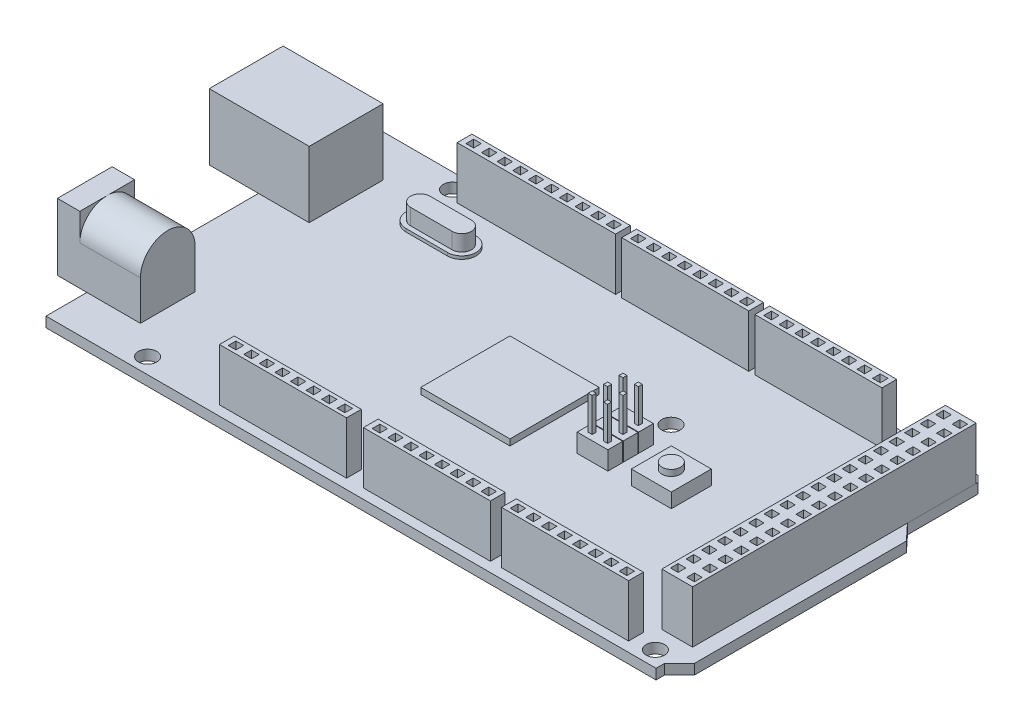
from build123d import *

# Parameters (mm, degrees)
SKETCH3_R            = 1.5
BOSS_EXTRUDE1_DEPTH  = 1.65
SKETCH4_W            = 16.25
SKETCH4_H            = 12
BOSS_EXTRUDE2_DEPTH  = 10.75
SKETCH5_W            = 13.5
SKETCH5_H            = 8.9
BOSS_EXTRUDE3_DEPTH  = 10.85
CUT_EXTRUDE1_DEPTH   = 9.85
SKETCH7_W            = 5.7
SKETCH7_H            = 3.15
CUT_EXTRUDE2_DEPTH   = 13
SKETCH8_R            = 3
SKETCH8_R_2          = 0.75
CUT_EXTRUDE3_DEPTH   = 10
FILLET1_R            = 0.75
SKETCH9_W            = 5
SKETCH9_H            = 46.1
SKETCH9_W_2          = 1.25
SKETCH9_H_2          = 1.25
BOSS_EXTRUDE4_DEPTH  = 8.5
SKETCH10_W           = 25.75
SKETCH10_H           = 2.4
SKETCH10_W_2         = 1.25
SKETCH10_H_2         = 1.25
SKETCH10_W_3         = 20.65
BOSS_EXTRUDE6_DEPTH  = 8.5
SKETCH11_W           = 14.5
SKETCH11_H           = 14.5
BOSS_EXTRUDE7_DEPTH  = 1
BOSS_EXTRUDE8_DEPTH  = 0.5
BOSS_EXTRUDE9_DEPTH  = 2.6
SKETCH14_W           = 5
SKETCH14_H           = 2.4
BOSS_EXTRUDE10_DEPTH = 3
SKETCH15_W           = 0.65
SKETCH15_H           = 0.65
BOSS_EXTRUDE11_DEPTH = 5.5
SKETCH16_W           = 6.5
SKETCH16_H           = 6.5
BOSS_EXTRUDE12_DEPTH = 2.35
SKETCH17_R           = 1.5
BOSS_EXTRUDE13_DEPTH = 1


with BuildPart() as part:
    # Sketch3 → Boss-Extrude1 (new body)
    with BuildSketch(Plane(origin=(0, 0, 0), x_dir=(1, 0, 0), z_dir=(0, 1, 0))):
        Polygon((-50.8, -26.67), (48.367298703, -26.67), (48.367298703, -25.307134577), (50.8, -22.87443328), (50.8, 11.598588355), (48.367298703, 14.201289652), (48.367298703, 25.67), (47.367298703, 26.67), (-50.8, 26.67), align=None)
        with Locations(Location((-36.83, -24.13, 0), (0, 0, 270))):
            Circle(SKETCH3_R, mode=Mode.SUBTRACT)
        with Locations(Location((15.24, -19.05, 0), (0, 0, 270))):
            Circle(SKETCH3_R, mode=Mode.SUBTRACT)
        with Locations(Location((45.72, -24.13, 0), (0, 0, 270))):
            Circle(SKETCH3_R, mode=Mode.SUBTRACT)
        with Locations(Location((-35.56, 24.17, 0), (0, 0, 270))):
            Circle(SKETCH3_R, mode=Mode.SUBTRACT)
        with Locations(Location((15.3, 8.83, 0), (0, 0, 270))):
            Circle(SKETCH3_R, mode=Mode.SUBTRACT)
        with Locations(Location((39.37, 24.17, 0), (0, 0, 270))):
            Circle(SKETCH3_R, mode=Mode.SUBTRACT)
    extrude(amount=BOSS_EXTRUDE1_DEPTH)

    # Sketch10 → Boss-Extrude6 (add)
    # profile 1 of 6: a face of its own
    with BuildSketch(Plane(origin=(0, 1.65, 0), x_dir=(1, 0, 0), z_dir=(0, 1, 0))):
        with Locations((-20.425, 23.87)):
            Rectangle(SKETCH10_W, SKETCH10_H)
        with Locations((-11.558333333, 23.87)):
            Rectangle(SKETCH10_W_2, SKETCH10_H_2, mode=Mode.SUBTRACT)
        with Locations((-9.025, 23.87)):
            Rectangle(SKETCH10_W_2, SKETCH10_H_2, mode=Mode.SUBTRACT)
        with Locations((-14.091666667, 23.87)):
            Rectangle(SKETCH10_W_2, SKETCH10_H_2, mode=Mode.SUBTRACT)
        with Locations((-16.625, 23.87)):
            Rectangle(SKETCH10_W_2, SKETCH10_H_2, mode=Mode.SUBTRACT)
        with Locations((-19.158333333, 23.87)):
            Rectangle(SKETCH10_W_2, SKETCH10_H_2, mode=Mode.SUBTRACT)
        with Locations((-21.691666667, 23.87)):
            Rectangle(SKETCH10_W_2, SKETCH10_H_2, mode=Mode.SUBTRACT)
        with Locations((-24.225, 23.87)):
            Rectangle(SKETCH10_W_2, SKETCH10_H_2, mode=Mode.SUBTRACT)
        with Locations((-26.758333333, 23.87)):
            Rectangle(SKETCH10_W_2, SKETCH10_H_2, mode=Mode.SUBTRACT)
        with Locations((-29.291666667, 23.87)):
            Rectangle(SKETCH10_W_2, SKETCH10_H_2, mode=Mode.SUBTRACT)
        with Locations((-31.825, 23.87)):
            Rectangle(SKETCH10_W_2, SKETCH10_H_2, mode=Mode.SUBTRACT)
    # profile 2 of 6: a face of its own
    with BuildSketch(Plane(origin=(0, 1.65, 0), x_dir=(1, 0, 0), z_dir=(0, 1, 0))):
        with Locations((3.775, 23.87)):
            Rectangle(SKETCH10_W_3, SKETCH10_H)
        with Locations((10.096428571, 23.87)):
            Rectangle(SKETCH10_W_2, SKETCH10_H_2, mode=Mode.SUBTRACT)
        with Locations((12.625, 23.87)):
            Rectangle(SKETCH10_W_2, SKETCH10_H_2, mode=Mode.SUBTRACT)
        with Locations((7.567857143, 23.87)):
            Rectangle(SKETCH10_W_2, SKETCH10_H_2, mode=Mode.SUBTRACT)
        with Locations((5.039285714, 23.87)):
            Rectangle(SKETCH10_W_2, SKETCH10_H_2, mode=Mode.SUBTRACT)
        with Locations((2.510714286, 23.87)):
            Rectangle(SKETCH10_W_2, SKETCH10_H_2, mode=Mode.SUBTRACT)
        with Locations((-0.017857143, 23.87)):
            Rectangle(SKETCH10_W_2, SKETCH10_H_2, mode=Mode.SUBTRACT)
        with Locations((-2.546428571, 23.87)):
            Rectangle(SKETCH10_W_2, SKETCH10_H_2, mode=Mode.SUBTRACT)
        with Locations((-5.075, 23.87)):
            Rectangle(SKETCH10_W_2, SKETCH10_H_2, mode=Mode.SUBTRACT)
    # profile 3 of 6: a face of its own
    with BuildSketch(Plane(origin=(0, 1.65, 0), x_dir=(1, 0, 0), z_dir=(0, 1, 0))):
        with Locations((25.425, 23.87)):
            Rectangle(SKETCH10_W_3, SKETCH10_H)
        with Locations((31.746428571, 23.87)):
            Rectangle(SKETCH10_W_2, SKETCH10_H_2, mode=Mode.SUBTRACT)
        with Locations((34.275, 23.87)):
            Rectangle(SKETCH10_W_2, SKETCH10_H_2, mode=Mode.SUBTRACT)
        with Locations((29.217857143, 23.87)):
            Rectangle(SKETCH10_W_2, SKETCH10_H_2, mode=Mode.SUBTRACT)
        with Locations((26.689285714, 23.87)):
            Rectangle(SKETCH10_W_2, SKETCH10_H_2, mode=Mode.SUBTRACT)
        with Locations((24.160714286, 23.87)):
            Rectangle(SKETCH10_W_2, SKETCH10_H_2, mode=Mode.SUBTRACT)
        with Locations((21.632142857, 23.87)):
            Rectangle(SKETCH10_W_2, SKETCH10_H_2, mode=Mode.SUBTRACT)
        with Locations((19.103571429, 23.87)):
            Rectangle(SKETCH10_W_2, SKETCH10_H_2, mode=Mode.SUBTRACT)
        with Locations((16.575, 23.87)):
            Rectangle(SKETCH10_W_2, SKETCH10_H_2, mode=Mode.SUBTRACT)
    # profile 4 of 6: a face of its own
    with BuildSketch(Plane(origin=(0, 1.65, 0), x_dir=(1, 0, 0), z_dir=(0, 1, 0))):
        with Locations((31.975, -23.87)):
            Rectangle(SKETCH10_W_3, SKETCH10_H)
        with Locations((38.296428571, -23.87)):
            Rectangle(SKETCH10_W_2, SKETCH10_H_2, mode=Mode.SUBTRACT)
        with Locations((40.825, -23.87)):
            Rectangle(SKETCH10_W_2, SKETCH10_H_2, mode=Mode.SUBTRACT)
        with Locations((35.767857143, -23.87)):
            Rectangle(SKETCH10_W_2, SKETCH10_H_2, mode=Mode.SUBTRACT)
        with Locations((33.239285714, -23.87)):
            Rectangle(SKETCH10_W_2, SKETCH10_H_2, mode=Mode.SUBTRACT)
        with Locations((30.710714286, -23.87)):
            Rectangle(SKETCH10_W_2, SKETCH10_H_2, mode=Mode.SUBTRACT)
        with Locations((28.182142857, -23.87)):
            Rectangle(SKETCH10_W_2, SKETCH10_H_2, mode=Mode.SUBTRACT)
        with Locations((25.653571429, -23.87)):
            Rectangle(SKETCH10_W_2, SKETCH10_H_2, mode=Mode.SUBTRACT)
        with Locations((23.125, -23.87)):
            Rectangle(SKETCH10_W_2, SKETCH10_H_2, mode=Mode.SUBTRACT)
    # profile 5 of 6: a face of its own
    with BuildSketch(Plane(origin=(0, 1.65, 0), x_dir=(1, 0, 0), z_dir=(0, 1, 0))):
        with Locations((9.525, -23.87)):
            Rectangle(SKETCH10_W_3, SKETCH10_H)
        with Locations((18.375, -23.87)):
            Rectangle(SKETCH10_W_2, SKETCH10_H_2, mode=Mode.SUBTRACT)
        with Locations((15.846428571, -23.87)):
            Rectangle(SKETCH10_W_2, SKETCH10_H_2, mode=Mode.SUBTRACT)
        with Locations((13.317857143, -23.87)):
            Rectangle(SKETCH10_W_2, SKETCH10_H_2, mode=Mode.SUBTRACT)
        with Locations((10.789285714, -23.87)):
            Rectangle(SKETCH10_W_2, SKETCH10_H_2, mode=Mode.SUBTRACT)
        with Locations((8.260714286, -23.87)):
            Rectangle(SKETCH10_W_2, SKETCH10_H_2, mode=Mode.SUBTRACT)
        with Locations((5.732142857, -23.87)):
            Rectangle(SKETCH10_W_2, SKETCH10_H_2, mode=Mode.SUBTRACT)
        with Locations((3.203571429, -23.87)):
            Rectangle(SKETCH10_W_2, SKETCH10_H_2, mode=Mode.SUBTRACT)
        with Locations((0.675, -23.87)):
            Rectangle(SKETCH10_W_2, SKETCH10_H_2, mode=Mode.SUBTRACT)
    # profile 6 of 6: a face of its own
    with BuildSketch(Plane(origin=(0, 1.65, 0), x_dir=(1, 0, 0), z_dir=(0, 1, 0))):
        with Locations((-13.875, -23.87)):
            Rectangle(SKETCH10_W_3, SKETCH10_H)
        with Locations((-7.553571429, -23.87)):
            Rectangle(SKETCH10_W_2, SKETCH10_H_2, mode=Mode.SUBTRACT)
        with Locations((-5.025, -23.87)):
            Rectangle(SKETCH10_W_2, SKETCH10_H_2, mode=Mode.SUBTRACT)
        with Locations((-10.082142857, -23.87)):
            Rectangle(SKETCH10_W_2, SKETCH10_H_2, mode=Mode.SUBTRACT)
        with Locations((-12.610714286, -23.87)):
            Rectangle(SKETCH10_W_2, SKETCH10_H_2, mode=Mode.SUBTRACT)
        with Locations((-15.139285714, -23.87)):
            Rectangle(SKETCH10_W_2, SKETCH10_H_2, mode=Mode.SUBTRACT)
        with Locations((-17.667857143, -23.87)):
            Rectangle(SKETCH10_W_2, SKETCH10_H_2, mode=Mode.SUBTRACT)
        with Locations((-20.196428571, -23.87)):
            Rectangle(SKETCH10_W_2, SKETCH10_H_2, mode=Mode.SUBTRACT)
        with Locations((-22.725, -23.87)):
            Rectangle(SKETCH10_W_2, SKETCH10_H_2, mode=Mode.SUBTRACT)
    extrude(amount=BOSS_EXTRUDE6_DEPTH)

    # Sketch11 → Boss-Extrude7 (add)
    with BuildSketch(Plane(origin=(0, 1.65, 0), x_dir=(1, 0, 0), z_dir=(0, 1, 0))):
        with Locations((-2.05, 0)):
            Rectangle(SKETCH11_W, SKETCH11_H)
    extrude(amount=BOSS_EXTRUDE7_DEPTH)

    # Sketch12 → Boss-Extrude8 (add)
    with BuildSketch(Plane(origin=(0, 1.65, 0), x_dir=(1, 0, 0), z_dir=(0, 1, 0))):
        with BuildLine():
            Line((-33.375, 19.07), (-26.625, 19.07))
            ThreePointArc((-26.625, 19.07), (-24.3, 16.745), (-26.625, 14.42))
            Line((-26.625, 14.42), (-33.375, 14.42))
            ThreePointArc((-33.375, 14.42), (-35.7, 16.745), (-33.375, 19.07))
        make_face()
    extrude(amount=BOSS_EXTRUDE8_DEPTH)

    # Sketch13 → Boss-Extrude9 (add)
    with BuildSketch(Plane(origin=(0, 2.15, 0), x_dir=(1, 0, 0), z_dir=(0, 1, 0))):
        with BuildLine():
            Line((-33.375, 18.32), (-26.625, 18.32))
            ThreePointArc((-26.625, 18.32), (-25.05, 16.745), (-26.625, 15.17))
            Line((-26.625, 15.17), (-33.375, 15.17))
            ThreePointArc((-33.375, 15.17), (-34.95, 16.745), (-33.375, 18.32))
        make_face()
    extrude(amount=BOSS_EXTRUDE9_DEPTH)

    # Sketch14 → Boss-Extrude10 (add)
    with BuildSketch(Plane(origin=(0, 1.65, 0), x_dir=(1, 0, 0), z_dir=(0, 1, 0))):
        with Locations((14.2, 0.87)):
            Rectangle(SKETCH14_W, SKETCH14_H)
        with Locations((14.2, -1.63)):
            Rectangle(SKETCH14_W, SKETCH14_H)
        with Locations((14.2, 3.37)):
            Rectangle(SKETCH14_W, SKETCH14_H)
    extrude(amount=BOSS_EXTRUDE10_DEPTH)

    # Sketch15 → Boss-Extrude11 (add)
    with BuildSketch(Plane(origin=(0, 4.65, 0), x_dir=(1, 0, 0), z_dir=(0, 1, 0))):
        with Locations((15.45, -1.63)):
            Rectangle(SKETCH15_W, SKETCH15_H)
        with Locations((12.95, -1.63)):
            Rectangle(SKETCH15_W, SKETCH15_H)
        with Locations((15.45, 0.87)):
            Rectangle(SKETCH15_W, SKETCH15_H)
        with Locations((12.95, 0.87)):
            Rectangle(SKETCH15_W, SKETCH15_H)
        with Locations((15.45, 3.37)):
            Rectangle(SKETCH15_W, SKETCH15_H)
        with Locations((12.95, 3.37)):
            Rectangle(SKETCH15_W, SKETCH15_H)
    extrude(amount=BOSS_EXTRUDE11_DEPTH)

    # Sketch16 → Boss-Extrude12 (add)
    with BuildSketch(Plane(origin=(0, 1.65, 0), x_dir=(1, 0, 0), z_dir=(0, 1, 0))):
        with Locations((23.9, 0.28)):
            Rectangle(SKETCH16_W, SKETCH16_H)
    extrude(amount=BOSS_EXTRUDE12_DEPTH)

    # Sketch17 → Boss-Extrude13 (add)
    with BuildSketch(Plane(origin=(0, 4, 0), x_dir=(1, 0, 0), z_dir=(0, 1, 0))):
        with Locations(Location((23.9, 0.28, 0), (0, 0, 90))):
            Circle(SKETCH17_R)
    extrude(amount=BOSS_EXTRUDE13_DEPTH)


with BuildPart() as body_2:
    # Sketch4 → Boss-Extrude2 (new body)
    with BuildSketch(Plane(origin=(0, 1.65, 0), x_dir=(1, 0, 0), z_dir=(0, 1, 0))):
        with Locations((-50.675, 13.87)):
            Rectangle(SKETCH4_W, SKETCH4_H)
    extrude(amount=BOSS_EXTRUDE2_DEPTH)

    # Sketch7 → Cut-Extrude2 (cut)
    with BuildSketch(Plane.ZY.offset(58.8)):
        Polygon((-18.22, 2.95), (-9.52, 2.95), (-9.52, 9.1), (-11.52, 11.1), (-16.22, 11.1), (-18.22, 9.1), align=None)
        with Locations((-13.87, 7.025)):
            Rectangle(SKETCH7_W, SKETCH7_H, mode=Mode.SUBTRACT)
    extrude(amount=-CUT_EXTRUDE2_DEPTH, mode=Mode.SUBTRACT)


with BuildPart() as body_3:
    # Sketch5 → Boss-Extrude3 (new body)
    with BuildSketch(Plane(origin=(0, 1.65, 0), x_dir=(1, 0, 0), z_dir=(0, 1, 0))):
        with Locations((-48.85, -15.57)):
            Rectangle(SKETCH5_W, SKETCH5_H)
    extrude(amount=BOSS_EXTRUDE3_DEPTH)

    # Sketch6 → Cut-Extrude1 (cut)
    with BuildSketch(Plane(origin=(-42.1, 0, 0), x_dir=(0, 0, -1), z_dir=(1, 0, 0))):
        with BuildLine():
            Line((-20.02, 8.05), (-20.02, 13.329014648))
            Line((-20.02, 13.329014648), (-11.12, 13.329014648))
            Line((-11.12, 13.329014648), (-11.12, 8.05))
            ThreePointArc((-11.12, 8.05), (-15.57, 12.5), (-20.02, 8.05))
        make_face()
    extrude(amount=-CUT_EXTRUDE1_DEPTH, mode=Mode.SUBTRACT)

    # Sketch8 → Cut-Extrude3 (cut)
    with BuildSketch(Plane.ZY.offset(55.6)):
        with Locations((15.57, 8.05)):
            Circle(SKETCH8_R)
        with Locations((15.57, 8.05)):
            Circle(SKETCH8_R_2, mode=Mode.SUBTRACT)
    extrude(amount=-CUT_EXTRUDE3_DEPTH, mode=Mode.SUBTRACT)

    # Fillet1
    fillet1_edges = [body_3.edges().sort_by_distance(p)[0] for p in [
        (-55.6, 8.05, 14.82),
    ]]
    fillet(fillet1_edges, radius=FILLET1_R)


with BuildPart() as body_4:
    # Sketch9 → Boss-Extrude4 (new body)
    with BuildSketch(Plane(origin=(0, 1.65, 0), x_dir=(1, 0, 0), z_dir=(0, 1, 0))):
        with Locations((45.867298703, 2.32)):
            Rectangle(SKETCH9_W, SKETCH9_H)
        with Locations((44.542298703, -19.255)):
            Rectangle(SKETCH9_W_2, SKETCH9_H_2, mode=Mode.SUBTRACT)
        with Locations((47.192298703, -19.255)):
            Rectangle(SKETCH9_W_2, SKETCH9_H_2, mode=Mode.SUBTRACT)
        with Locations((44.542298703, -16.716764706)):
            Rectangle(SKETCH9_W_2, SKETCH9_H_2, mode=Mode.SUBTRACT)
        with Locations((47.192298703, -16.716764706)):
            Rectangle(SKETCH9_W_2, SKETCH9_H_2, mode=Mode.SUBTRACT)
        with Locations((44.542298703, -14.178529412)):
            Rectangle(SKETCH9_W_2, SKETCH9_H_2, mode=Mode.SUBTRACT)
        with Locations((47.192298703, -14.178529412)):
            Rectangle(SKETCH9_W_2, SKETCH9_H_2, mode=Mode.SUBTRACT)
        with Locations((44.542298703, -11.640294118)):
            Rectangle(SKETCH9_W_2, SKETCH9_H_2, mode=Mode.SUBTRACT)
        with Locations((47.192298703, -11.640294118)):
            Rectangle(SKETCH9_W_2, SKETCH9_H_2, mode=Mode.SUBTRACT)
        with Locations((44.542298703, -9.102058824)):
            Rectangle(SKETCH9_W_2, SKETCH9_H_2, mode=Mode.SUBTRACT)
        with Locations((47.192298703, -9.102058824)):
            Rectangle(SKETCH9_W_2, SKETCH9_H_2, mode=Mode.SUBTRACT)
        with Locations((44.542298703, -6.563823529)):
            Rectangle(SKETCH9_W_2, SKETCH9_H_2, mode=Mode.SUBTRACT)
        with Locations((47.192298703, -6.563823529)):
            Rectangle(SKETCH9_W_2, SKETCH9_H_2, mode=Mode.SUBTRACT)
        with Locations((44.542298703, -4.025588235)):
            Rectangle(SKETCH9_W_2, SKETCH9_H_2, mode=Mode.SUBTRACT)
        with Locations((47.192298703, -4.025588235)):
            Rectangle(SKETCH9_W_2, SKETCH9_H_2, mode=Mode.SUBTRACT)
        with Locations((44.542298703, -1.487352941)):
            Rectangle(SKETCH9_W_2, SKETCH9_H_2, mode=Mode.SUBTRACT)
        with Locations((47.192298703, -1.487352941)):
            Rectangle(SKETCH9_W_2, SKETCH9_H_2, mode=Mode.SUBTRACT)
        with Locations((44.542298703, 1.050882353)):
            Rectangle(SKETCH9_W_2, SKETCH9_H_2, mode=Mode.SUBTRACT)
        with Locations((47.192298703, 1.050882353)):
            Rectangle(SKETCH9_W_2, SKETCH9_H_2, mode=Mode.SUBTRACT)
        with Locations((44.542298703, 3.589117647)):
            Rectangle(SKETCH9_W_2, SKETCH9_H_2, mode=Mode.SUBTRACT)
        with Locations((47.192298703, 3.589117647)):
            Rectangle(SKETCH9_W_2, SKETCH9_H_2, mode=Mode.SUBTRACT)
        with Locations((44.542298703, 6.127352941)):
            Rectangle(SKETCH9_W_2, SKETCH9_H_2, mode=Mode.SUBTRACT)
        with Locations((47.192298703, 6.127352941)):
            Rectangle(SKETCH9_W_2, SKETCH9_H_2, mode=Mode.SUBTRACT)
        with Locations((44.542298703, 8.665588235)):
            Rectangle(SKETCH9_W_2, SKETCH9_H_2, mode=Mode.SUBTRACT)
        with Locations((47.192298703, 8.665588235)):
            Rectangle(SKETCH9_W_2, SKETCH9_H_2, mode=Mode.SUBTRACT)
        with Locations((44.542298703, 11.203823529)):
            Rectangle(SKETCH9_W_2, SKETCH9_H_2, mode=Mode.SUBTRACT)
        with Locations((47.192298703, 11.203823529)):
            Rectangle(SKETCH9_W_2, SKETCH9_H_2, mode=Mode.SUBTRACT)
        with Locations((44.542298703, 13.742058824)):
            Rectangle(SKETCH9_W_2, SKETCH9_H_2, mode=Mode.SUBTRACT)
        with Locations((47.192298703, 13.742058824)):
            Rectangle(SKETCH9_W_2, SKETCH9_H_2, mode=Mode.SUBTRACT)
        with Locations((44.542298703, 16.280294118)):
            Rectangle(SKETCH9_W_2, SKETCH9_H_2, mode=Mode.SUBTRACT)
        with Locations((47.192298703, 16.280294118)):
            Rectangle(SKETCH9_W_2, SKETCH9_H_2, mode=Mode.SUBTRACT)
        with Locations((44.542298703, 18.818529412)):
            Rectangle(SKETCH9_W_2, SKETCH9_H_2, mode=Mode.SUBTRACT)
        with Locations((47.192298703, 18.818529412)):
            Rectangle(SKETCH9_W_2, SKETCH9_H_2, mode=Mode.SUBTRACT)
        with Locations((44.542298703, 21.356764706)):
            Rectangle(SKETCH9_W_2, SKETCH9_H_2, mode=Mode.SUBTRACT)
        with Locations((47.192298703, 21.356764706)):
            Rectangle(SKETCH9_W_2, SKETCH9_H_2, mode=Mode.SUBTRACT)
        with Locations((44.542298703, 23.895)):
            Rectangle(SKETCH9_W_2, SKETCH9_H_2, mode=Mode.SUBTRACT)
        with Locations((47.192298703, 23.895)):
            Rectangle(SKETCH9_W_2, SKETCH9_H_2, mode=Mode.SUBTRACT)
    extrude(amount=BOSS_EXTRUDE4_DEPTH)


solid = Compound([part.part, body_2.part, body_3.part, body_4.part])
